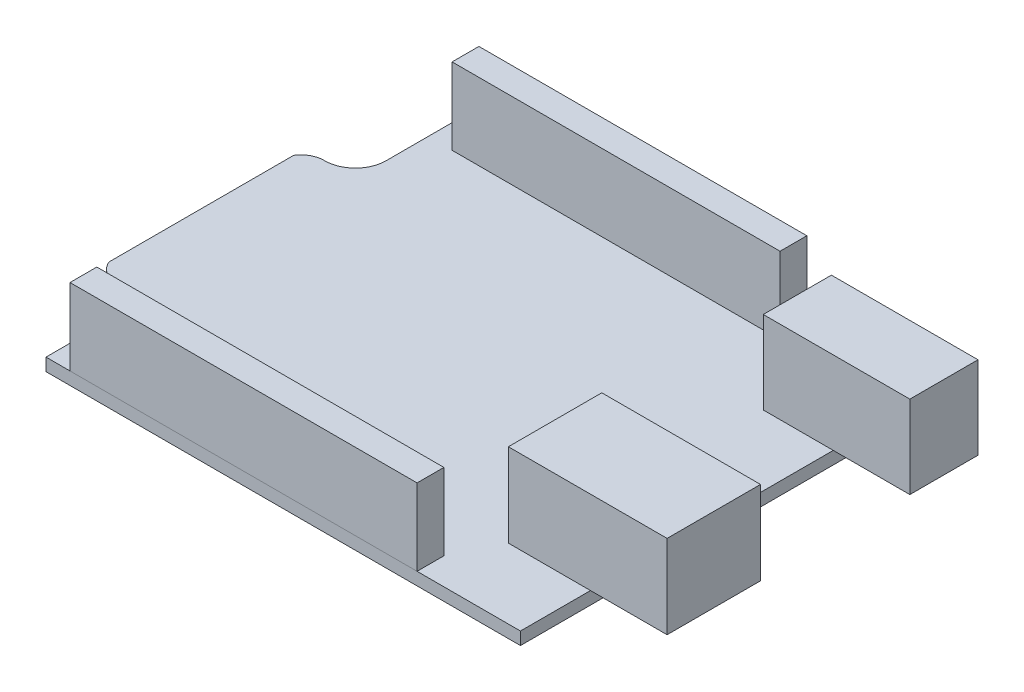
from build123d import *

# Parameters (mm, degrees)
SKETCH1_W             = 68.6
SKETCH1_H             = 53.4
BOSS_EXTRUDE1_DEPTH   = 11.65
CUT_EXTRUDE1_DEPTH    = 11.65
CUT_EXTRUDE29_DEPTH   = 10
SKETCH3_W             = 45.321894132
SKETCH3_H             = 3.5031306
BOSS_EXTRUDE2_DEPTH   = 10
SKETCH3_W_2           = 42.821894132
SKETCH3_H_2           = 3.500805672
BOSS_EXTRUDE2_2_DEPTH = 10
SKETCH9_W             = 10.72679272
SKETCH9_H             = 12.2
BOSS_EXTRUDE3_DEPTH   = 10.9
SKETCH10_W            = 12.2
SKETCH10_H            = 10.9
BOSS_EXTRUDE4_DEPTH   = 10
SKETCH11_W            = 9.141898724
SKETCH11_H            = 8.9
BOSS_EXTRUDE5_DEPTH   = 10.8
SKETCH12_W            = 8.9
SKETCH12_H            = 10.8
BOSS_EXTRUDE6_DEPTH   = 10


with BuildPart() as part:
    # Sketch1 → Boss-Extrude1 (new body)
    with BuildSketch(Plane(origin=(0, 0, 0), x_dir=(1, 0, 0), z_dir=(0, 1, 0))):
        Rectangle(SKETCH1_W, SKETCH1_H)
    extrude(amount=BOSS_EXTRUDE1_DEPTH)

    # Sketch2 → Cut-Extrude1 (cut)
    with BuildSketch(Plane(origin=(0, 11.65, 0), x_dir=(1, 0, 0), z_dir=(0, 1, 0))):
        with BuildLine():
            Line((-34.3, -26.7), (-27.654315978, -26.7))
            Line((-27.654315978, -26.7), (-27.654315978, -17.7))
            ThreePointArc((-27.654315978, -17.7), (-28.79828375, -14.89945007), (-31.575855934, -13.700769571))
            ThreePointArc((-31.575855934, -13.700769571), (-33.220484723, -13.170795461), (-34.3, -11.821601932))
            Line((-34.3, -11.821601932), (-34.3, -26.7))
        make_face()
        with BuildLine():
            ThreePointArc((-27.654315978, 17.7), (-28.845145426, 14.852446522), (-31.708596382, 13.700368312))
            ThreePointArc((-31.708596382, 13.700368312), (-33.191338295, 13.331337389), (-34.3, 12.279873349))
            Line((-34.3, 12.279873349), (-34.3, 26.7))
            Line((-34.3, 26.7), (-27.654315978, 26.7))
            Line((-27.654315978, 26.7), (-27.654315978, 17.7))
        make_face()
    extrude(amount=-CUT_EXTRUDE1_DEPTH, mode=Mode.SUBTRACT)

    # Sketch7 → Cut-Extrude29 (cut)
    with BuildSketch(Plane(origin=(0, 11.65, 0), x_dir=(1, 0, 0), z_dir=(0, 1, 0))):
        with BuildLine():
            Line((-27.654315978, -17.7), (-27.654315978, -26.7))
            Line((-27.654315978, -26.7), (34.3, -26.7))
            Line((34.3, -26.7), (34.3, 26.7))
            Line((34.3, 26.7), (-27.654315978, 26.7))
            Line((-27.654315978, 26.7), (-27.654315978, 17.7))
            ThreePointArc((-27.654315978, 17.7), (-28.845145426, 14.852446522), (-31.708596382, 13.700368312))
            ThreePointArc((-31.708596382, 13.700368312), (-33.191338295, 13.331337389), (-34.3, 12.279873349))
            Line((-34.3, 12.279873349), (-34.3, -11.821601932))
            ThreePointArc((-34.3, -11.821601932), (-33.220484723, -13.170795461), (-31.575855934, -13.700769571))
            ThreePointArc((-31.575855934, -13.700769571), (-28.79828375, -14.89945007), (-27.654315978, -17.7))
        make_face()
    extrude(amount=-CUT_EXTRUDE29_DEPTH, mode=Mode.SUBTRACT)

    # Sketch9 → Boss-Extrude3 (add)
    with BuildSketch(Plane(origin=(0, 1.65, 0), x_dir=(1, 0, 0), z_dir=(0, 1, 0))):
        with Locations((28.93660364, -11.45)):
            Rectangle(SKETCH9_W, SKETCH9_H)
    extrude(amount=BOSS_EXTRUDE3_DEPTH)

    # Sketch10 → Boss-Extrude4 (add)
    with BuildSketch(Plane(origin=(34.3, 0, 0), x_dir=(0, 0, -1), z_dir=(1, 0, 0))):
        with Locations((-11.45, 7.1)):
            Rectangle(SKETCH10_W, SKETCH10_H)
    extrude(amount=BOSS_EXTRUDE4_DEPTH)

    # Sketch11 → Boss-Extrude5 (add)
    with BuildSketch(Plane(origin=(0, 1.65, 0), x_dir=(1, 0, 0), z_dir=(0, 1, 0))):
        with Locations((29.729050638, 18.6)):
            Rectangle(SKETCH11_W, SKETCH11_H)
    extrude(amount=BOSS_EXTRUDE5_DEPTH)

    # Sketch12 → Boss-Extrude6 (add)
    with BuildSketch(Plane(origin=(34.3, 0, 0), x_dir=(0, 0, -1), z_dir=(1, 0, 0))):
        with Locations((18.6, 7.05)):
            Rectangle(SKETCH12_W, SKETCH12_H)
    extrude(amount=BOSS_EXTRUDE6_DEPTH)


with BuildPart() as body_2:
    # Sketch3 → Boss-Extrude2 (new body)
    with BuildSketch(Plane(origin=(0, 11.65, 0), x_dir=(1, 0, 0), z_dir=(0, 1, 0))):
        with Locations((-1.860947066, -24.9484347)):
            Rectangle(SKETCH3_W, SKETCH3_H)
    extrude(amount=-BOSS_EXTRUDE2_DEPTH)


with BuildPart() as body_3:
    # Sketch3 → Boss-Extrude2 2 (new body)
    with BuildSketch(Plane(origin=(0, 11.65, 0), x_dir=(1, 0, 0), z_dir=(0, 1, 0))):
        with Locations((-3.110947066, 24.949597164)):
            Rectangle(SKETCH3_W_2, SKETCH3_H_2)
    extrude(amount=-BOSS_EXTRUDE2_2_DEPTH)


solid = Compound([part.part, body_2.part, body_3.part])
